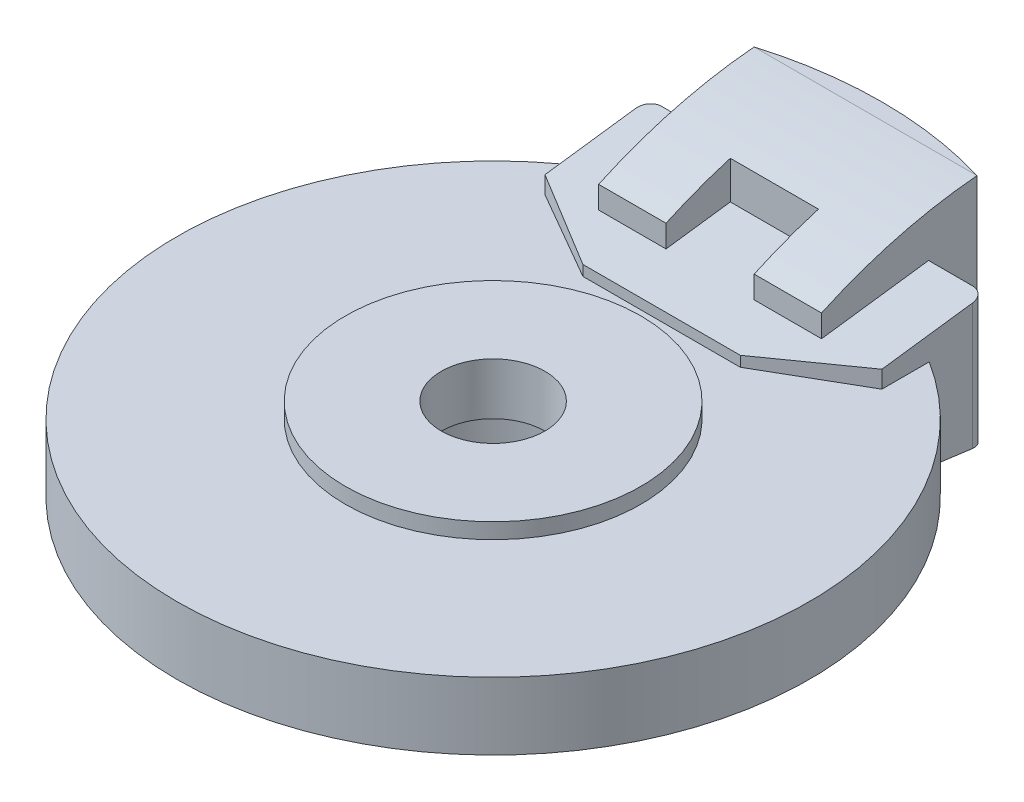
from build123d import *
from OCP.BRepFilletAPI import BRepFilletAPI_MakeChamfer

# Parameters (mm, degrees)
SKETCH1_R                 = 6.1
BOSS_EXTRUDE1_DEPTH       = 1.3
SKETCH2_R                 = 2.85
BOSS_EXTRUDE2_DEPTH       = 0.3
SKETCH5_R                 = 3.45
BOSS_EXTRUDE3_DEPTH       = 0.2
F_2_0MM_DOWEL_HOLE1_D     = 2
F_2_0MM_DOWEL_HOLE1_DEPTH = 52.32
F_2_0MM_DOWEL_HOLE1_TIP   = 0.600860619
SKETCH6_R                 = 2.6
SKETCH6_R_2               = 2.1
BOSS_EXTRUDE4_DEPTH       = 0.8
CUT_EXTRUDE1_START        = -1.6
SKETCH8_R                 = 2.1
CUT_EXTRUDE1_DEPTH        = 1.6
BOSS_EXTRUDE5_DEPTH       = 1.9
BOSS_EXTRUDE5_DEPTH_BACK  = 0.6
SKETCH9_W                 = 6.5
SKETCH9_H                 = 3
CHAMFER1_SIZE             = 1
CHAMFER1_SIZE2            = 1.732050808
CUT_EXTRUDE2_DEPTH        = 12.405919516
CUT_EXTRUDE2_DEPTH_BACK   = 12.405919516
BOSS_EXTRUDE6_DEPTH       = 2.2
BOSS_EXTRUDE6_DEPTH_BACK  = 2
BOSS_EXTRUDE6_START       = 0.65
CUT_EXTRUDE3_DEPTH        = 10
FILLET1_R                 = 0.25


with BuildPart() as part:
    # Sketch1 → Boss-Extrude1 (new body)
    with BuildSketch(Plane(origin=(0, 0, 0), x_dir=(1, 0, 0), z_dir=(0, 1, 0))):
        with Locations(Location((0, 0, 0), (0, 0, 270))):
            Circle(SKETCH1_R)
    extrude(amount=BOSS_EXTRUDE1_DEPTH)

    # Sketch2 → Boss-Extrude2 (add)
    with BuildSketch(Plane(origin=(0, 1.3, 0), x_dir=(1, 0, 0), z_dir=(0, 1, 0))):
        with Locations(Location((0, 0, 0), (0, 0, 270))):
            Circle(SKETCH2_R)
    extrude(amount=BOSS_EXTRUDE2_DEPTH)

    # Sketch5 → Boss-Extrude3 (add)
    with BuildSketch(Plane.XZ):
        with Locations(Location((0, 0, 0), (0, 0, 270))):
            Circle(SKETCH5_R)
    extrude(amount=BOSS_EXTRUDE3_DEPTH)

    # Ø2.0mm Dowel Hole1
    with Locations(Plane(origin=(0, 1.6, 0), x_dir=(1, 0, 0), z_dir=(0, 1, 0))):
        with Locations((0, 0)):
            Hole(F_2_0MM_DOWEL_HOLE1_D / 2, depth=F_2_0MM_DOWEL_HOLE1_DEPTH)
            with Locations((0, 0, -(F_2_0MM_DOWEL_HOLE1_DEPTH + F_2_0MM_DOWEL_HOLE1_TIP / 2))):  # 118° drill point
                Cone(0, F_2_0MM_DOWEL_HOLE1_D / 2, F_2_0MM_DOWEL_HOLE1_TIP, mode=Mode.SUBTRACT)

    # Sketch6 → Boss-Extrude4 (add)
    with BuildSketch(Plane.XZ.offset(0.2)):
        with Locations(Location((0, 0, 0), (0, 0, 270))):
            Circle(SKETCH6_R)
        with Locations(Location((0, 0, 0), (0, 0, 270))):
            Circle(SKETCH6_R_2, mode=Mode.SUBTRACT)
    extrude(amount=BOSS_EXTRUDE4_DEPTH)

    # Sketch8 → Cut-Extrude1 (cut)
    with BuildSketch(Plane.XZ.offset(1).offset(CUT_EXTRUDE1_START)):
        with Locations(Location((0, 0, 0), (0, 0, 270))):
            Circle(SKETCH8_R)
    extrude(amount=CUT_EXTRUDE1_DEPTH, mode=Mode.SUBTRACT)

    # Sketch9 → Boss-Extrude5 (add, two sides: drawn at the far end of the back side and taken through both)
    with BuildSketch(Plane(origin=(0, 0, 0), x_dir=(1, 0, 0), z_dir=(0, 1, 0)).offset(-BOSS_EXTRUDE5_DEPTH_BACK)):
        with Locations((0, 4.75)):
            Rectangle(SKETCH9_W, SKETCH9_H)
    extrude(amount=BOSS_EXTRUDE5_DEPTH + BOSS_EXTRUDE5_DEPTH_BACK)

    # Chamfer1: one chamfer whose edges measure the first distance from different faces: ONE call of the kernel's chamfer builder (chamfer() names one face for all edges)
    chamfer1_edges_1 = [part.edges().sort_by_distance(p)[0] for p in [
        (3.25, -0.3, -3.25),
        (3.25, 1.6, -3.25),
    ]]
    chamfer1_side_1 = [part.faces().sort_by_distance(p)[0] for p in [
        (3.25, 1.6, -3.289051248),
    ]]
    chamfer1_edges_2 = [part.edges().sort_by_distance(p)[0] for p in [
        (-3.25, 1.6, -3.25),
        (-3.25, -0.3, -3.25),
    ]]
    chamfer1_side_2 = [part.faces().sort_by_distance(p)[0] for p in [
        (-3.25, 0.65, -6.210948752),
    ]]
    chamfer1 = BRepFilletAPI_MakeChamfer(part.part.solid().wrapped)
    for e in chamfer1_edges_1:
        chamfer1.Add(CHAMFER1_SIZE, CHAMFER1_SIZE2, e.wrapped, chamfer1_side_1[0].wrapped)  # the first distance lies on this face
    for e in chamfer1_edges_2:
        chamfer1.Add(CHAMFER1_SIZE, CHAMFER1_SIZE2, e.wrapped, chamfer1_side_2[0].wrapped)  # the first distance lies on this face
    add(Compound.cast(chamfer1.Shape()), mode=Mode.REPLACE)

    # Sketch10 → Cut-Extrude2 (cut, two sides: drawn at the far end of the back side and taken through both)
    with BuildSketch(Plane(origin=(3.25, 0, 0), x_dir=(0, 0, -1), z_dir=(1, 0, 0)).offset(-CUT_EXTRUDE2_DEPTH_BACK)):
        Polygon((3.25, 1.500247446), (6.25, 1.9), (3.25, 1.9), align=None)
        Polygon((3.25, -0.6), (6.25, -0.6), (3.25, -0.2), align=None)
    extrude(amount=CUT_EXTRUDE2_DEPTH + CUT_EXTRUDE2_DEPTH_BACK, mode=Mode.SUBTRACT)

    # Sketch11 → Boss-Extrude6 (add, two sides: drawn at the far end of the back side and taken through both)
    with BuildSketch(Plane(origin=(0, 0, 0), x_dir=(1, 0, 0), z_dir=(0, 1, 0)).offset(BOSS_EXTRUDE6_START - BOSS_EXTRUDE6_DEPTH_BACK)):
        with BuildLine():
            Line((-2.15, 7.185227902), (-2.15, 4.185227902))
            Line((-2.15, 4.185227902), (-0.85, 4.185227902))
            Line((-0.85, 4.185227902), (-0.85, 5.425500648))
            Line((-0.85, 5.425500648), (0.85, 5.425500648))
            Line((0.85, 5.425500648), (0.85, 4.185227902))
            Line((0.85, 4.185227902), (2.15, 4.185227902))
            Line((2.15, 4.185227902), (2.15, 7.185227902))
            ThreePointArc((2.15, 7.185227902), (0, 7.5), (-2.15, 7.185227902))
        make_face()
    extrude(amount=BOSS_EXTRUDE6_DEPTH + BOSS_EXTRUDE6_DEPTH_BACK)

    # Sketch12 → Cut-Extrude3 (cut)
    with BuildSketch(Plane.ZY.offset(2.15)):
        with BuildLine():
            Line((-7.185227902, 2.85), (-4.185227902, 2.85))
            Line((-4.185227902, 2.85), (-4.185227902, 2.05486736))
            ThreePointArc((-4.185227902, 2.05486736), (-5.650660459, 2.582855102), (-7.185227902, 2.85))
        make_face()
        with BuildLine():
            Line((-4.185227902, -0.754697054), (-4.185227902, -1.35))
            Line((-4.185227902, -1.35), (-7.185227902, -1.35))
            ThreePointArc((-7.185227902, -1.35), (-5.659726016, -1.180864031), (-4.185227902, -0.754697054))
        make_face()
    extrude(amount=-CUT_EXTRUDE3_DEPTH, mode=Mode.SUBTRACT)

    # Fillet1
    fillet1_edges = [part.edges().sort_by_distance(p)[0] for p in [
        (-3.25, 0.65, -6.25),
        (3.25, 0.65, -6.25),
    ]]
    fillet(fillet1_edges, radius=FILLET1_R)


solid = part.part
